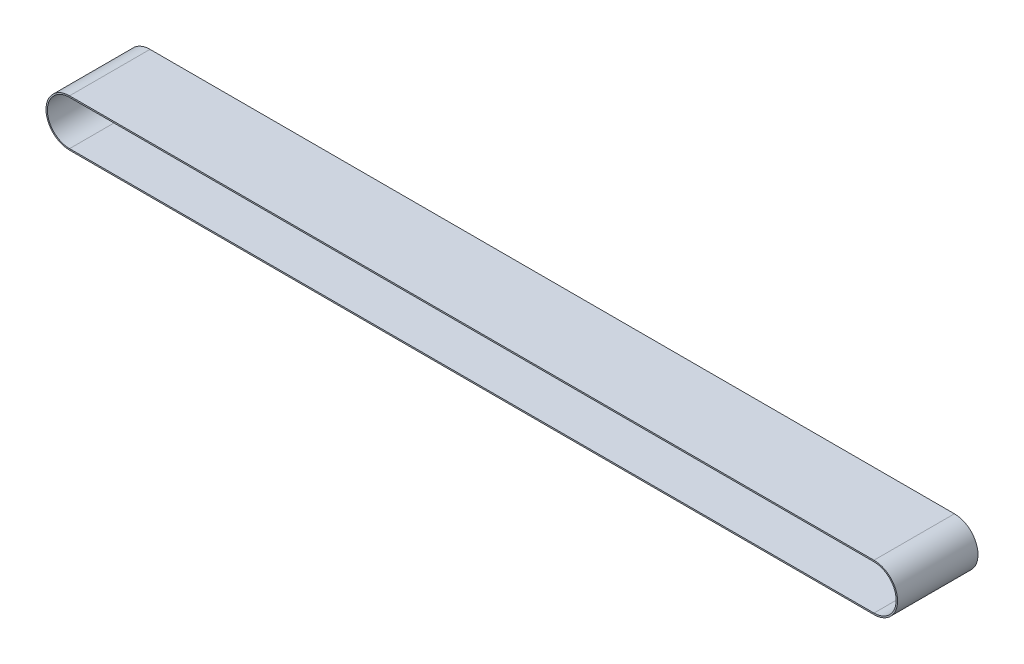
from build123d import *

# Parameters (mm, degrees)
BOSS_EXTRUDE1_DEPTH = 58


with BuildPart() as part:
    # Sketch1 → Boss-Extrude1 (new body)
    with BuildSketch(Plane.XY):
        with BuildLine():
            Line((0, 17), (580, 17))
            ThreePointArc((580, 17), (597, 0), (580, -17))
            Line((580, -17), (0, -17))
            ThreePointArc((0, -17), (-17, 0), (0, 17))
        make_face()
        with BuildLine():
            Line((0, 16), (580, 16))
            ThreePointArc((580, 16), (596, 0), (580, -16))
            Line((580, -16), (0, -16))
            ThreePointArc((0, -16), (-16, 0), (0, 16))
        make_face(mode=Mode.SUBTRACT)
    extrude(amount=BOSS_EXTRUDE1_DEPTH)


solid = part.part
